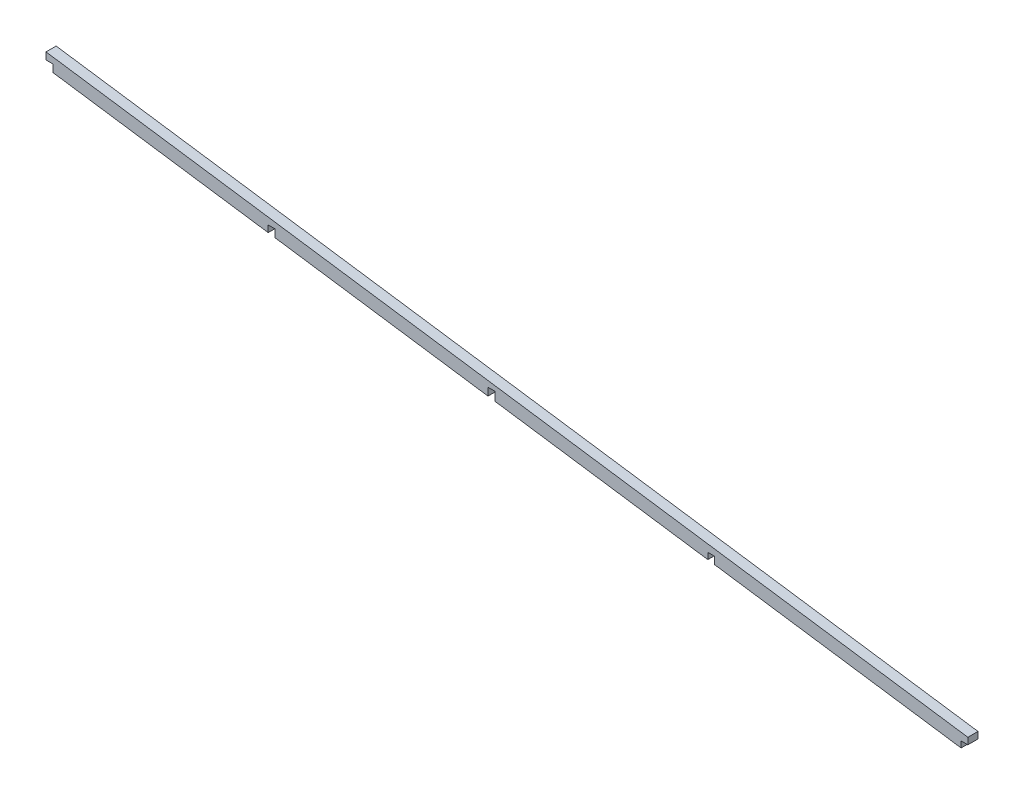
from build123d import *

# Parameters (mm, degrees)
EXTRUDE_2_DEPTH = 3


with BuildPart() as part:
    # Model → 凸台-拉伸2 (new body)
    with BuildSketch(Plane.XY):
        Polygon((23.041834876, 10.857458756), (86.741810061, 1.678339582), (86.741810061, 3.652674455), (88.741809775, 3.652674455), (88.741809775, 1.390172931), (151.741786892, -7.686781114), (151.741786892, -5.415325545), (153.741786607, -5.415325545), (153.741786607, -7.974940142), (216.741763723, -17.052091808), (216.741763723, -15.187325545), (218.741763438, -15.187325545), (218.741763438, -17.340255416), (281.741740555, -26.417407082), (291.638157863, -27.843300947), (291.638157863, -26.033172152), (293.638157578, -26.033172152), (293.638157578, -24.10125334), (21.041834876, 15.121214778), (21.041834876, 13.052512949), (23.041821305, 13.052512949), align=None)
    extrude(amount=EXTRUDE_2_DEPTH)


solid = part.part
